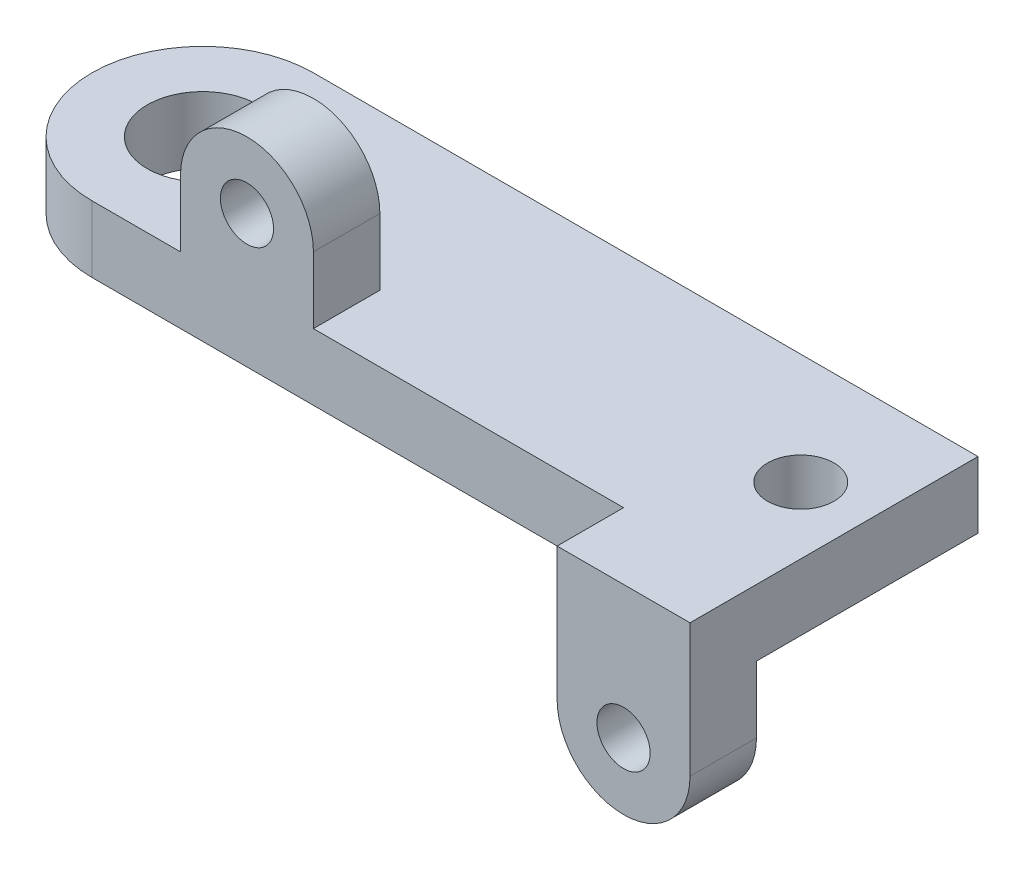
from build123d import *

# Parameters (mm, degrees)
SKETCH1_R           = 12.5
SKETCH1_R_2         = 7.5
BOSS_EXTRUDE1_DEPTH = 15
SKETCH1_3_W         = 30
SKETCH1_3_H         = 15
BOSS_EXTRUDE2_DEPTH = 45
BOSS_EXTRUDE3_START = 15
SKETCH1_4_W         = 30
SKETCH1_4_H         = 15
BOSS_EXTRUDE3_DEPTH = 45
CUT_EXTRUDE1_START  = 10
SKETCH3_R           = 6
CUT_EXTRUDE1_DEPTH  = 30


with BuildPart() as part:
    # Sketch1 → Boss-Extrude1 (new body)
    with BuildSketch(Plane(origin=(0, 0, 0), x_dir=(1, 0, 0), z_dir=(0, 1, 0))):
        with BuildLine():
            Line((150, 25), (0, 25))
            ThreePointArc((0, 25), (-25, 0), (0, -25))
            Line((0, -25), (20, -25))
            Line((20, -25), (20, -10))
            Line((20, -10), (50, -10))
            Line((50, -10), (50, -25))
            Line((50, -25), (120, -25))
            Line((120, -25), (150, -25))
            Line((150, -25), (150, 25))
        make_face()
        with Locations(Location((0, 0, 0), (0, 0, 270))):
            Circle(SKETCH1_R, mode=Mode.SUBTRACT)
        with Locations(Location((135, 0, 0), (0, 0, 270))):
            Circle(SKETCH1_R_2, mode=Mode.SUBTRACT)
    extrude(amount=BOSS_EXTRUDE1_DEPTH)

    # Sketch1<3> → Boss-Extrude2 (add)
    with BuildSketch(Plane(origin=(0, 0, 0), x_dir=(1, 0, 0), z_dir=(0, 1, 0))):
        with Locations((35, -17.5)):
            Rectangle(SKETCH1_3_W, SKETCH1_3_H)
    extrude(amount=BOSS_EXTRUDE2_DEPTH)

    # Sketch1<4> → Boss-Extrude3 (add)
    with BuildSketch(Plane(origin=(0, 0, 0), x_dir=(1, 0, 0), z_dir=(0, 1, 0)).offset(BOSS_EXTRUDE3_START)):
        with Locations((135, -32.5)):
            Rectangle(SKETCH1_4_W, SKETCH1_4_H)
    extrude(amount=-BOSS_EXTRUDE3_DEPTH)

    # Sketch3 → Cut-Extrude1 (cut)
    with BuildSketch(Plane.XY.offset(CUT_EXTRUDE1_START)):
        with BuildLine():
            ThreePointArc((35, 45), (45.606601718, 40.606601718), (50, 30))
            Line((50, 30), (50, 45))
            Line((50, 45), (35, 45))
        make_face()
        with BuildLine():
            Line((20, 45), (20, 30))
            ThreePointArc((20, 30), (24.393398282, 40.606601718), (35, 45))
            Line((35, 45), (20, 45))
        make_face()
        with Locations(Location((35, 30, 0), (0, 0, 180))):
            Circle(SKETCH3_R)
        with BuildLine():
            ThreePointArc((150, -15), (135, -30), (120, -15))
            Line((120, -15), (120, -39.427079815))
            Line((120, -39.427079815), (150, -39.427079815))
            Line((150, -39.427079815), (150, -15))
        make_face()
        with Locations(Location((135, -15, 0), (0, 0, 180))):
            Circle(SKETCH3_R)
    extrude(amount=CUT_EXTRUDE1_DEPTH, mode=Mode.SUBTRACT)


solid = part.part
